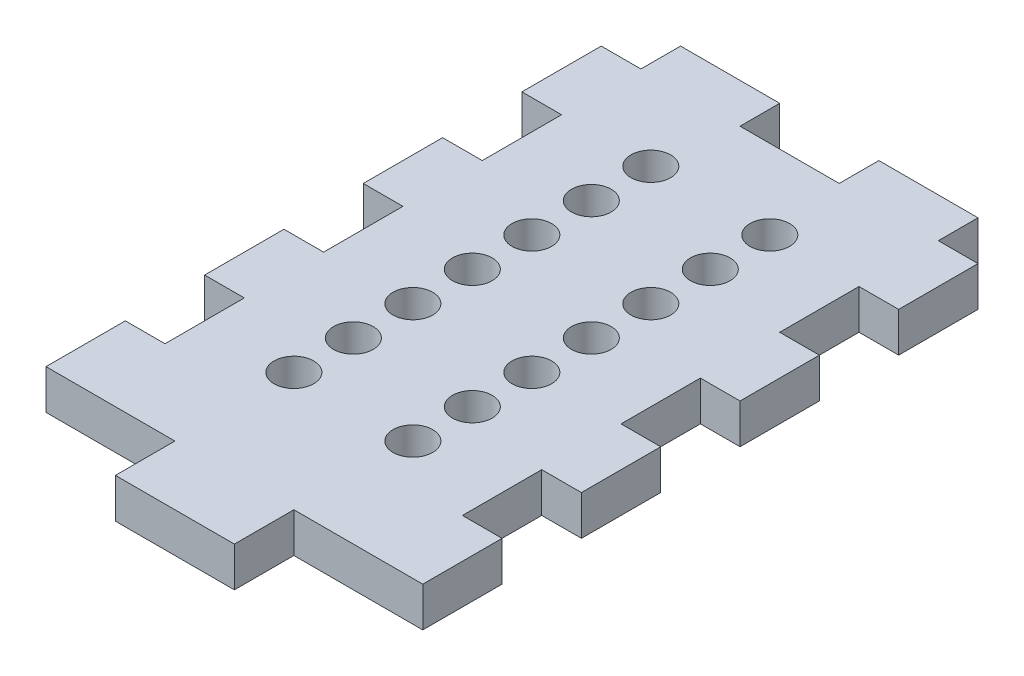
from build123d import *

# Parameters (mm, degrees)
SKETCH1_R           = 2
BOSS_EXTRUDE1_DEPTH = 4


with BuildPart() as part:
    # Sketch1 → Boss-Extrude1 (new body)
    with BuildSketch(Plane(origin=(0, 0, 0), x_dir=(1, 0, 0), z_dir=(0, 1, 0))):
        Polygon((5, 26), (-5, 26), (-5, 30), (-15, 30), (-15, 26), (-19, 26), (-19, 18), (-15, 18), (-15, 10), (-19, 10), (-19, 2), (-15, 2), (-15, -6), (-19, -6), (-19, -14), (-15, -14), (-15, -22), (-19, -22), (-19, -30), (-15, -30), (-6, -30), (-6, -36), (6, -36), (6, -30), (15, -30), (19, -30), (19, -22), (15, -22), (15, -14), (19, -14), (19, -6), (15, -6), (15, 2), (19, 2), (19, 10), (15, 10), (15, 18), (19, 18), (19, 26), (15, 26), (15, 30), (5, 30), align=None)
        with BuildLine():
            ThreePointArc((-4, -18), (-6, -20), (-8, -18))
            ThreePointArc((-8, -18), (-6, -16), (-4, -18))
        make_face(mode=Mode.SUBTRACT)
        with Locations(Location((-6, -12, 0), (0, 0, 270))):
            Circle(SKETCH1_R, mode=Mode.SUBTRACT)
        with Locations(Location((-6, -6, 0), (0, 0, 270))):
            Circle(SKETCH1_R, mode=Mode.SUBTRACT)
        with BuildLine():
            ThreePointArc((4, -18), (6, -16), (8, -18))
            ThreePointArc((8, -18), (6, -20), (4, -18))
        make_face(mode=Mode.SUBTRACT)
        with Locations(Location((6, -12, 0), (0, 0, 270))):
            Circle(SKETCH1_R, mode=Mode.SUBTRACT)
        with Locations(Location((6, -6, 0), (0, 0, 270))):
            Circle(SKETCH1_R, mode=Mode.SUBTRACT)
        with Locations(Location((-6, 0, 0), (0, 0, 270))):
            Circle(SKETCH1_R, mode=Mode.SUBTRACT)
        with Locations(Location((-6, 6, 0), (0, 0, 270))):
            Circle(SKETCH1_R, mode=Mode.SUBTRACT)
        with Locations(Location((-6, 12, 0), (0, 0, 270))):
            Circle(SKETCH1_R, mode=Mode.SUBTRACT)
        with BuildLine():
            ThreePointArc((-4, 18), (-6, 16), (-8, 18))
            ThreePointArc((-8, 18), (-6, 20), (-4, 18))
        make_face(mode=Mode.SUBTRACT)
        with Locations(Location((6, 0, 0), (0, 0, 270))):
            Circle(SKETCH1_R, mode=Mode.SUBTRACT)
        with Locations(Location((6, 6, 0), (0, 0, 270))):
            Circle(SKETCH1_R, mode=Mode.SUBTRACT)
        with Locations(Location((6, 12, 0), (0, 0, 270))):
            Circle(SKETCH1_R, mode=Mode.SUBTRACT)
        with BuildLine():
            ThreePointArc((4, 18), (6, 20), (8, 18))
            ThreePointArc((8, 18), (6, 16), (4, 18))
        make_face(mode=Mode.SUBTRACT)
    extrude(amount=BOSS_EXTRUDE1_DEPTH)


solid = part.part
